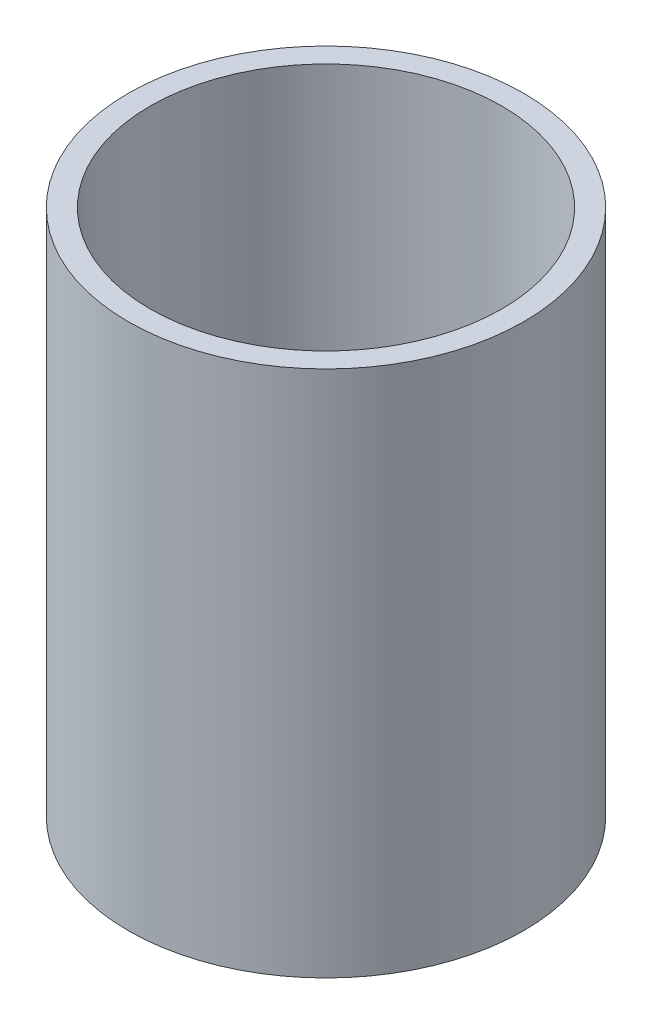
from build123d import *

# Parameters (mm, degrees)
SKETCH1_R           = 14.2875
SKETCH1_R_2         = 12.7
BOSS_EXTRUDE1_DEPTH = 38.1


with BuildPart() as part:
    # Sketch1 → Boss-Extrude1 (new body)
    with BuildSketch(Plane(origin=(0, 0, 0), x_dir=(1, 0, 0), z_dir=(0, 1, 0))):
        with Locations(Location((0, 0, 0), (0, 0, 90))):
            Circle(SKETCH1_R)
        with Locations(Location((0, 0, 0), (0, 0, 90))):
            Circle(SKETCH1_R_2, mode=Mode.SUBTRACT)
    extrude(amount=BOSS_EXTRUDE1_DEPTH)


solid = part.part
